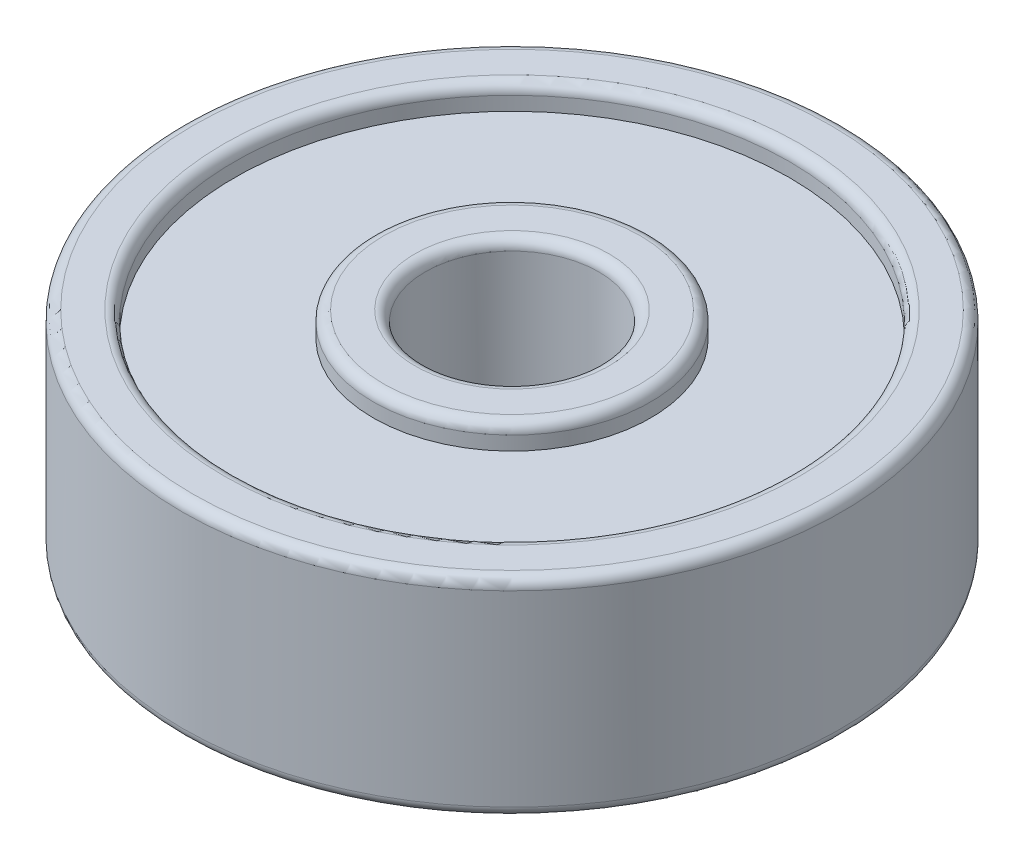
from build123d import *

# Parameters (mm, degrees)
FILLET_1_R = 0.3


with BuildPart() as part:
    # 草图1 → 旋转1 (revolve)
    with BuildSketch(Plane.XY, mode=Mode.PRIVATE) as revolve_1_sk:
        Polygon((2.5, 6), (2.5, 0), (4, 0), (4, 0.7), (8, 0.7), (8, 0), (9.5, 0), (9.5, 6), (8, 6), (8, 5.3), (4, 5.3), (4, 6), align=None)
    revolve(revolve_1_sk.sketch.rotate(Axis((0, 4.611296038, 0), (0, -1, 0)), 90), axis=Axis((0, 4.611296038, 0), (0, -1, 0)))

    # 圆角1
    fillet_1_edges = [part.edges().sort_by_distance(p)[0] for p in [
        (0, 6, -8),
        (0, 6, -9.5),
        (0, 0, -9.5),
        (0, 0, -8),
        (0, 0, -4),
        (0, 0, -2.5),
        (0, 6, -2.5),
        (0, 6, -4),
    ]]
    fillet(fillet_1_edges, radius=FILLET_1_R)


solid = part.part
